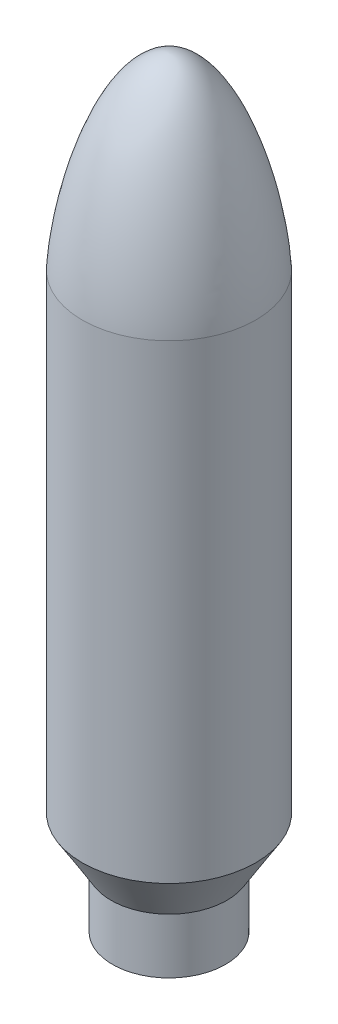
from build123d import *


with BuildPart() as part:
    # Sketch1 → Revolve1 (revolve)
    with BuildSketch(Plane.XY, mode=Mode.PRIVATE) as revolve1_sk:
        Polygon((-12.065, 0), (-12.065, 12), (-12.369, 12), (-18.5, 22), (-18.5, 122.28214657), (-17.5, 122.28214657), (-17.5, 22.28214657), (-11.809115938, 13), (-11.065, 13), (-11.065, 0), align=None)
    revolve(revolve1_sk.sketch.rotate(Axis((0, 0, 0), (0, 1, 0)), 270), axis=Axis((0, 0, 0), (0, 1, 0)))


with BuildPart() as body_2:
    # Sketch2 → Revolve3 (revolve)
    with BuildSketch(Plane.XY, mode=Mode.PRIVATE) as revolve3_sk:
        with BuildLine():
            Line((0, 118.28214657), (-16.3, 118.28214657))
            Line((-16.3, 118.28214657), (-17.3, 119.28214657))
            Line((-17.3, 119.28214657), (-17.3, 122.28214657))
            Line((-17.3, 122.28214657), (-18.5, 122.28214657))
            add(Edge.make_bspline(
                [(-18.5, 122.28214657), (-17.708553729, 136.992560015), (-10.521795872, 161.697040148), (0, 162.28214657)],
                knots=[0, 0, 0, 0, 1, 1, 1, 1], degree=3))
            Line((0, 162.28214657), (0, 118.28214657))
        make_face()
    revolve(revolve3_sk.sketch.rotate(Axis((0, 122.28214657, 0), (0, 1, 0)), 270), axis=Axis((0, 122.28214657, 0), (0, 1, 0)))


solid = Compound([part.part, body_2.part])
